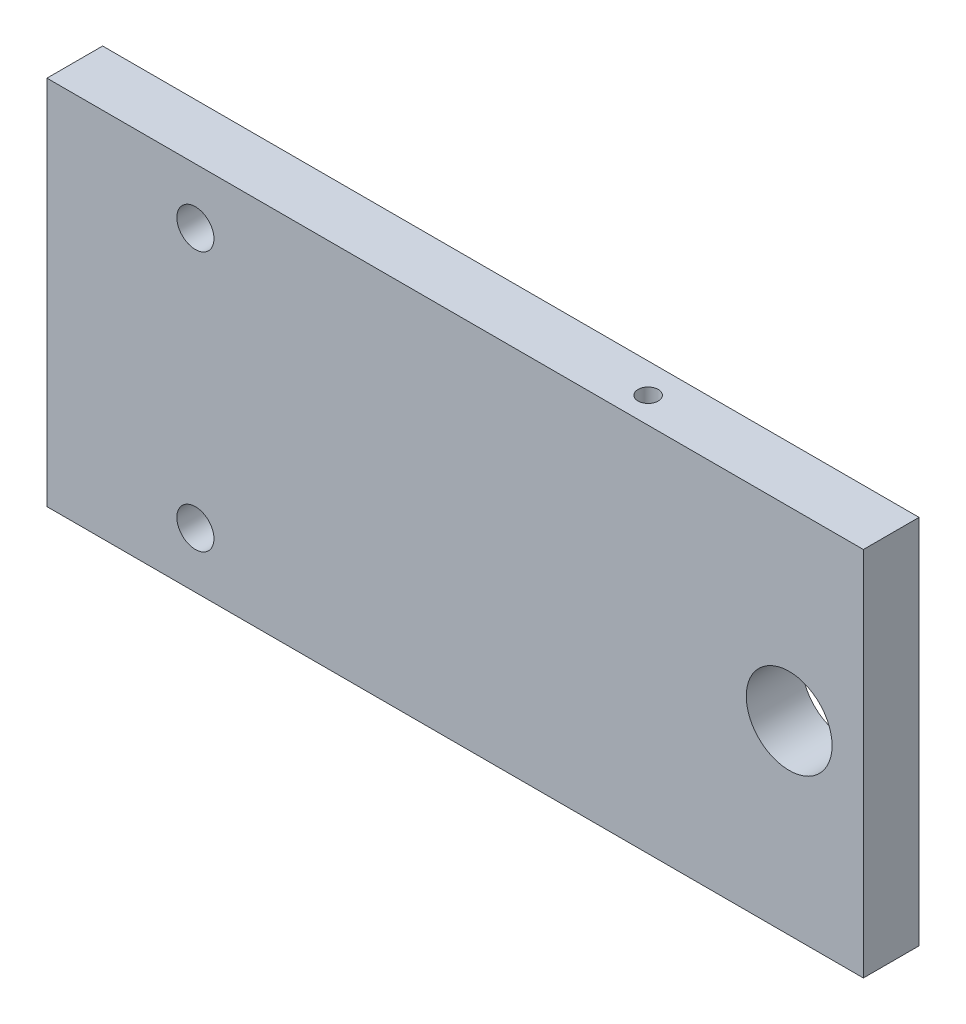
from build123d import *

# Parameters (mm, degrees)
SKETCH1_W                   = 139.7
SKETCH1_H                   = 63.5
BOSS_EXTRUDE1_DEPTH         = 9.525
F_5_8_18_TAPPED_HOLE1_D     = 14.68374
F_1_4_0_25_DIAMETER_HOLE1_D = 6.35
F_8_32_TAPPED_HOLE1_D       = 3.4544
F_8_32_TAPPED_HOLE1_DEPTH   = 12.7
F_8_32_TAPPED_HOLE1_TIP     = 1.037806461


with BuildPart() as part:
    # Sketch1 → Boss-Extrude1 (new body)
    with BuildSketch(Plane.XY):
        with Locations((69.85, 31.75)):
            Rectangle(SKETCH1_W, SKETCH1_H)
    extrude(amount=BOSS_EXTRUDE1_DEPTH)

    # 5/8-18 Tapped Hole1 (through all)
    with Locations(Plane.XY.offset(9.525)):
        with Locations((127, 31.75)):
            Hole(F_5_8_18_TAPPED_HOLE1_D / 2)

    # 1/4 (0.25) Diameter Hole1 (through all)
    with Locations(Plane(origin=(25.4, 53.975, 9.525), x_dir=(1, 0, 0), z_dir=(0, 0, 1))):
        with Locations((0, 0), (0, -44.45)):
            Hole(F_1_4_0_25_DIAMETER_HOLE1_D / 2)

    # #8-32 Tapped Hole1
    with Locations(Plane(origin=(98.425, 63.5, 5.08), x_dir=(0, 0, 1), z_dir=(0, 1, 0))):
        with Locations((0, 0)):
            Hole(F_8_32_TAPPED_HOLE1_D / 2, depth=F_8_32_TAPPED_HOLE1_DEPTH)
            with Locations((0, 0, -(F_8_32_TAPPED_HOLE1_DEPTH + F_8_32_TAPPED_HOLE1_TIP / 2))):  # 118° drill point
                Cone(0, F_8_32_TAPPED_HOLE1_D / 2, F_8_32_TAPPED_HOLE1_TIP, mode=Mode.SUBTRACT)


solid = part.part
